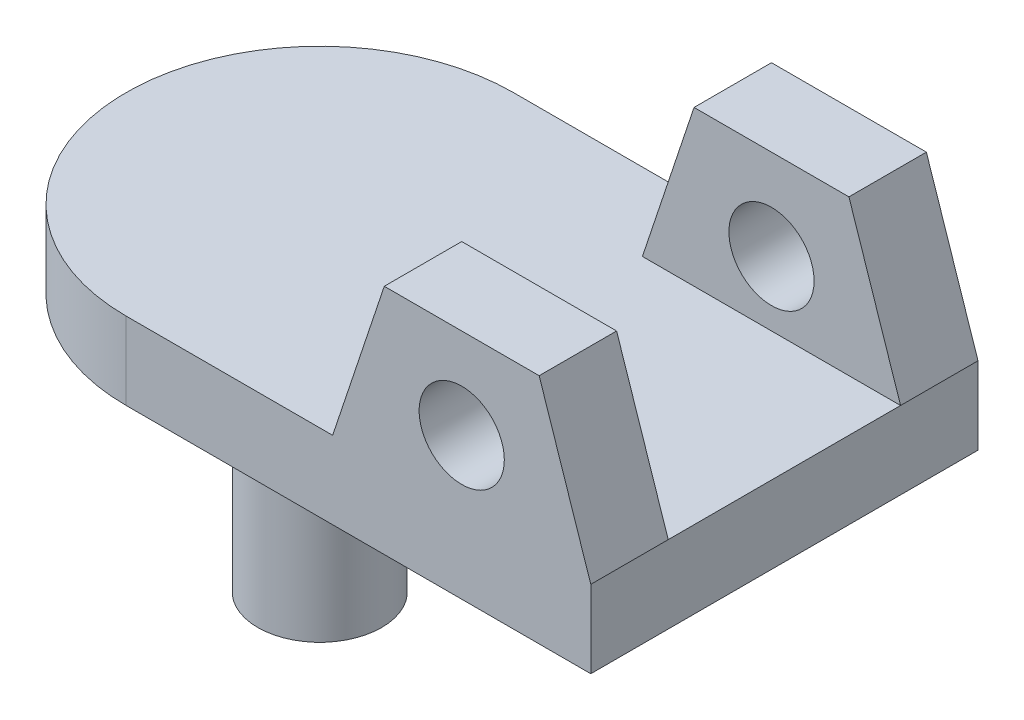
from build123d import *

# Parameters (mm, degrees)
EXTRUDE_1_DEPTH     = 3
SKETCH_2_R          = 2.4
EXTRUDE_2_DEPTH     = 10
EXTRUDE_3_DEPTH     = 3
SKETCH_4_R          = 1.65
CUT_EXTRUDE_1_DEPTH = 26.475478406


with BuildPart() as part:
    # 草图1 → 凸台-拉伸1 (new body)
    with BuildSketch(Plane(origin=(0, 0, 0), x_dir=(1, 0, 0), z_dir=(0, 1, 0))):
        with BuildLine():
            Line((0, 7.5), (18, 7.5))
            Line((18, 7.5), (18, -7.5))
            Line((18, -7.5), (0, -7.5))
            ThreePointArc((0, -7.5), (-7.5, 0), (0, 7.5))
        make_face()
    extrude(amount=EXTRUDE_1_DEPTH)

    # 草图2 → 凸台-拉伸2 (add)
    with BuildSketch(Plane.XZ):
        with Locations(Location((0, 0, 0), (0, 0, 90))):
            Circle(SKETCH_2_R)
    extrude(amount=EXTRUDE_2_DEPTH)

    # 草图3 → 凸台-拉伸3 (add)
    with BuildSketch(Plane.XY.offset(7.5)):
        Polygon((18, 3), (8, 3), (10, 9), (16, 9), align=None)
    extrude_3 = extrude(amount=-EXTRUDE_3_DEPTH)

    # 镜向1: 凸台-拉伸3 across plane
    add(extrude_3.mirror(Plane.XY))

    # 草图4 → 切除-拉伸1 (cut, through all)
    with BuildSketch(Plane.XY.offset(7.5)):
        with Locations((13, 5.5)):
            Circle(SKETCH_4_R)
    extrude(amount=-CUT_EXTRUDE_1_DEPTH, mode=Mode.SUBTRACT)


solid = part.part
